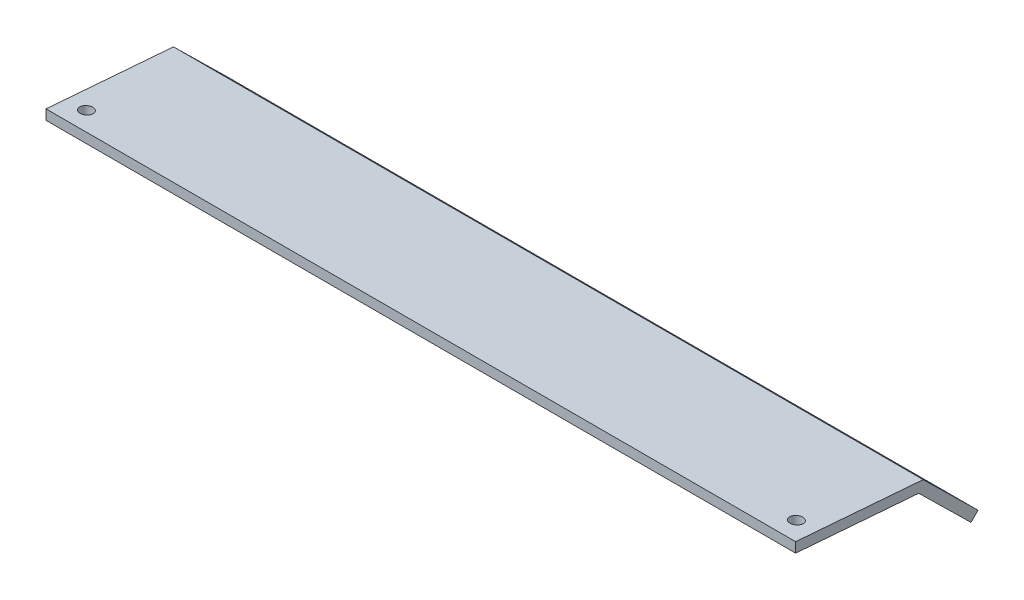
from build123d import *

# Parameters (mm, degrees)
BOSS_EXTRUDE1_DEPTH = 119.85625
SKETCH2_R           = 2.032
CUT_EXTRUDE1_DEPTH  = 136.095780221
SKETCH3_R           = 2.032
CUT_EXTRUDE2_DEPTH  = 12.7


with BuildPart() as part:
    # Sketch1 → Boss-Extrude1 (new, symmetric)
    with BuildSketch(Plane(origin=(0, 0, 0), x_dir=(0, 0, -1), z_dir=(1, 0, 0))):
        Polygon((0, 0), (0, 3.184811635), (40.762900177, -0.022300578), (58.304880654, -17.260912049), (56.079483543, -19.525472204), (39.361772519, -3.096875365), align=None)
    extrude(amount=BOSS_EXTRUDE1_DEPTH, both=True)

    # Sketch2 → Cut-Extrude1 (cut, through all)
    with BuildSketch(Plane(origin=(0, 3.165218593, -0.249030642), x_dir=(1, 0, 0), z_dir=(0, 0.9969192417821154, -0.0784348478966589))):
        with Locations(Location((113.50625, 6.354926815, 0), (0, 0, 270))):
            Circle(SKETCH2_R)
        with Locations(Location((-113.50625, 6.354926815, 0), (0, 0, 270))):
            Circle(SKETCH2_R)
    extrude(amount=-CUT_EXTRUDE1_DEPTH, mode=Mode.SUBTRACT)

    # Sketch3 → Cut-Extrude2 (cut)
    with BuildSketch(Plane(origin=(0, 20.36700431, -20.014779664), x_dir=(1, 0, 0), z_dir=(0, 0.7132472930974809, -0.7009124759120187))):
        with Locations(Location((-113.50625, 45.429186901, 0), (0, 0, 270))):
            Circle(SKETCH3_R)
        with Locations(Location((113.50625, 48.604186901, 0), (0, 0, 270))):
            Circle(SKETCH3_R)
    extrude(amount=-CUT_EXTRUDE2_DEPTH, mode=Mode.SUBTRACT)


solid = part.part
